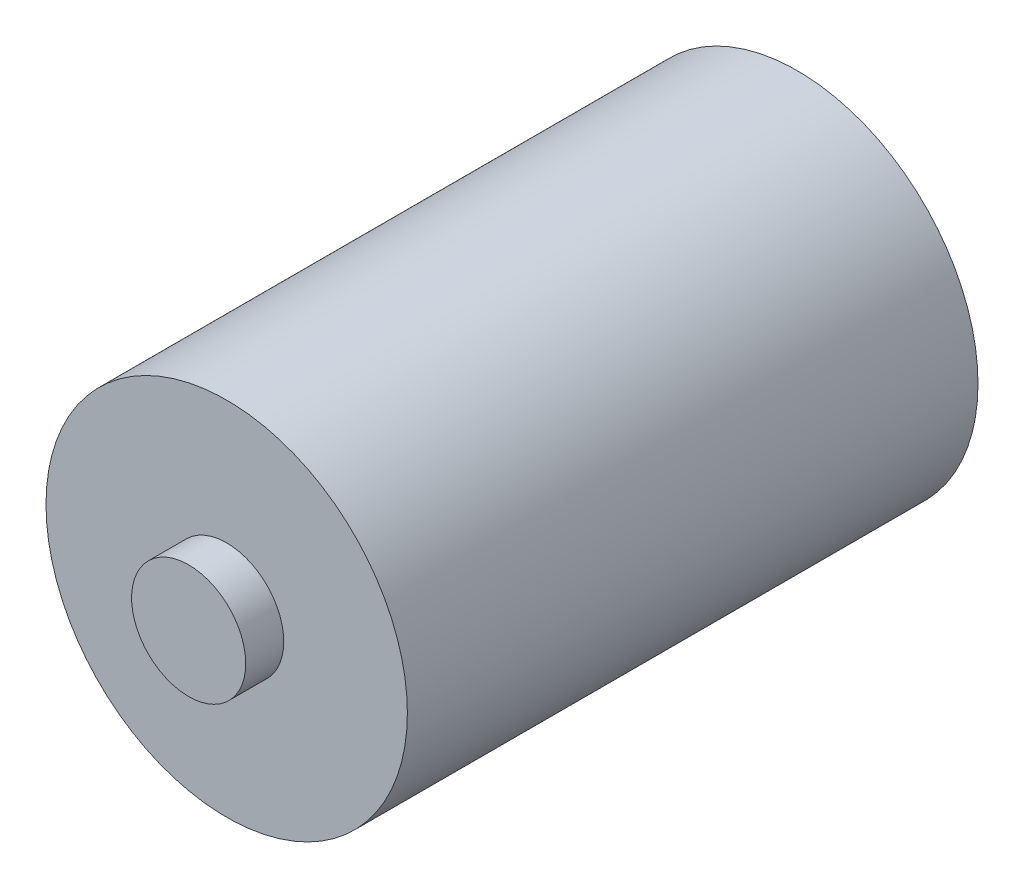
from build123d import *

# Parameters (mm, degrees)
SKETCH1_R                = 47.5
BOSS_EXTRUDE1_DEPTH      = 75
BOSS_EXTRUDE2_DEPTH      = 10
BOSS_EXTRUDE2_DEPTH_BACK = 160
SKETCH2_R                = 15


with BuildPart() as part:
    # Sketch1 → Boss-Extrude1 (new, symmetric)
    with BuildSketch(Plane.XY):
        Circle(SKETCH1_R)
    extrude(amount=BOSS_EXTRUDE1_DEPTH, both=True)

    # Sketch2 → Boss-Extrude2 (add, two sides: drawn at the far end of the back side and taken through both)
    with BuildSketch(Plane.XY.offset(75).offset(-BOSS_EXTRUDE2_DEPTH_BACK)):
        Circle(SKETCH2_R)
    extrude(amount=BOSS_EXTRUDE2_DEPTH + BOSS_EXTRUDE2_DEPTH_BACK)


solid = part.part
